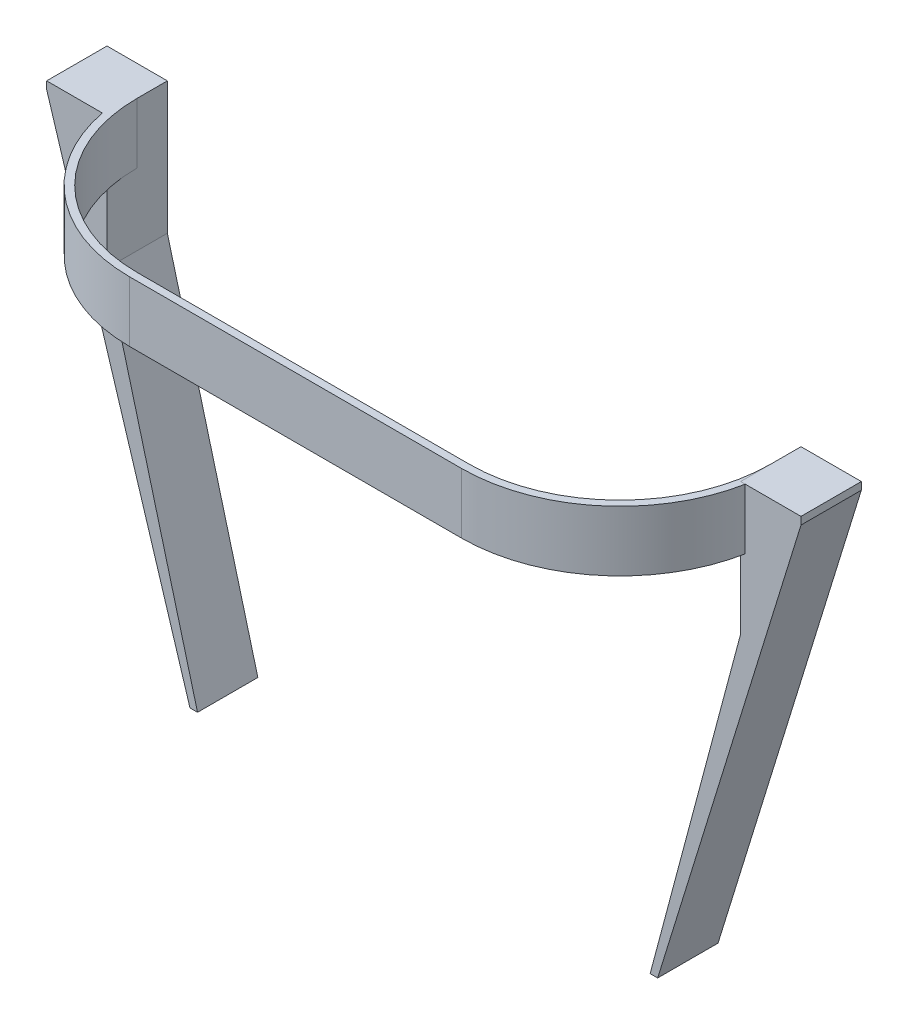
from build123d import *

# Parameters (mm, degrees)
EXTRUDE_3_DEPTH   = 32
EXTRUDE_3_2_DEPTH = 32
EXTRUDE_5_DEPTH   = 32


with BuildPart() as part:
    # 草图12 → 凸台-拉伸3 (new body)
    with BuildSketch(Plane.XY):
        Polygon((-124, 0), (-120, 0), (-168, 180), (-168, 250), (-200, 250), (-200, 246), align=None)
    extrude(amount=EXTRUDE_3_DEPTH)

    # 草图13 → 凸台-拉伸5 (add)
    with BuildSketch(Plane(origin=(0, 250, 0), x_dir=(1, 0, 0), z_dir=(0, 1, 0))):
        with BuildLine():
            Line((-88, -96), (88, -96))
            ThreePointArc((88, -96), (144.568542495, -72.568542495), (168, -16))
            Line((168, -16), (172, -16))
            ThreePointArc((172, -16), (147.39696962, -75.39696962), (88, -100))
            Line((88, -100), (-88, -100))
            ThreePointArc((-88, -100), (-147.39696962, -75.39696962), (-172, -16))
            Line((-172, -16), (-168, -16))
            ThreePointArc((-168, -16), (-144.568542495, -72.568542495), (-88, -96))
        make_face()
    extrude(amount=-EXTRUDE_5_DEPTH)


with BuildPart() as body_2:
    # 草图12 → Extrude 3 2 (new body)
    with BuildSketch(Plane.XY):
        Polygon((120, 0), (168, 180), (168, 250), (200, 250), (200, 246), (124, 0), align=None)
    extrude(amount=EXTRUDE_3_2_DEPTH)


solid = Compound([part.part, body_2.part])
